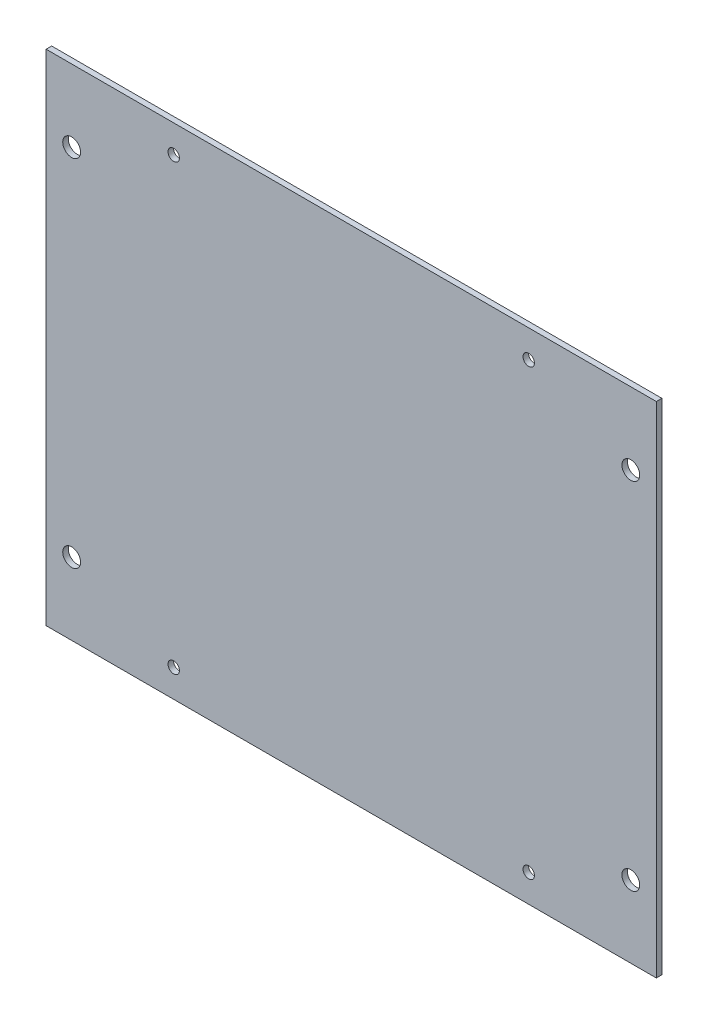
from build123d import *

# Parameters (mm, degrees)
SKETCH3_W              = 914.4
SKETCH3_H              = 609.6
BOSS_EXTRUDE1_DEPTH    = 0.79375
SKETCH4_OUTSIDE_W      = 1136.194
SKETCH4_OUTSIDE_H      = 831.394
CUT_EXTRUDE1_DEPTH     = 2.54
F_4_CLEARANCE_HOLE1_D  = 3.2639
F_10_CLEARANCE_HOLE1_D = 5.1054


with BuildPart() as part:
    # Sketch3 → Boss-Extrude1 (new, symmetric)
    with BuildSketch(Plane.XY):
        Rectangle(SKETCH3_W, SKETCH3_H)
    extrude(amount=BOSS_EXTRUDE1_DEPTH, both=True)

    # Sketch4 outside → Cut-Extrude1 (cut)
    with BuildSketch(Plane(origin=(0, 0, -0.79375), x_dir=(-1, 0, 0), z_dir=(0, 0, -1))):
        Rectangle(SKETCH4_OUTSIDE_W, SKETCH4_OUTSIDE_H)
        Polygon((387.349825772, -19.107241188), (212.724825222, -19.107241187), (212.724825222, 123.767758813), (387.349825755, 123.767758812), align=None, mode=Mode.SUBTRACT)
    extrude(amount=-CUT_EXTRUDE1_DEPTH, mode=Mode.SUBTRACT)

    # #4 Clearance Hole1 (through all)
    with Locations(Plane(origin=(0, 0, -0.79375), x_dir=(-1, 0, 0), z_dir=(0, 0, -1))):
        with Locations((350.837325504, 115.830258819), (249.237325504, 115.830258806), (249.23732552, -11.169741194), (350.83732552, -11.169741181)):
            Hole(F_4_CLEARANCE_HOLE1_D / 2)

    # #10 Clearance Hole1 (through all)
    with Locations(Plane(origin=(0, 0, -0.79375), x_dir=(-1, 0, 0), z_dir=(0, 0, -1))):
        with Locations((220.027325222, 1.530258305), (220.027325222, 103.129958819), (380.047325758, 103.130259319), (380.04732577, 1.530558805)):
            Hole(F_10_CLEARANCE_HOLE1_D / 2)


solid = part.part
